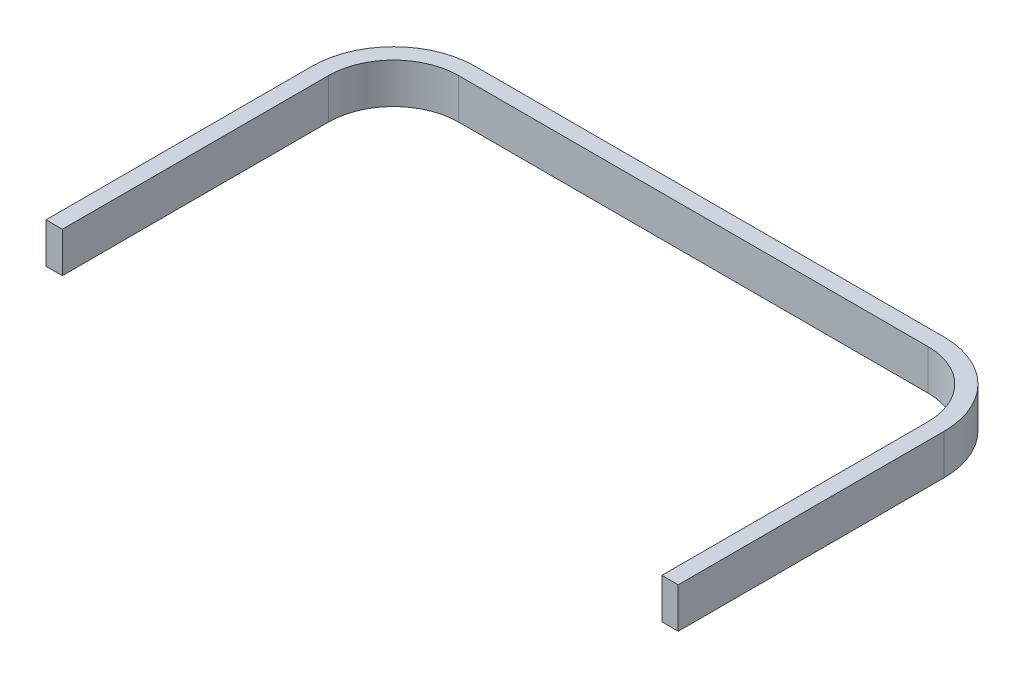
from build123d import *

# Parameters (mm, degrees)
SKETCH2_W = 42.447903748
SKETCH2_H = 104.615154758


with BuildPart() as part:
    # Sweep1: sweep along a path in Sketch1
    with BuildLine(Plane(origin=(0, 0, 0), x_dir=(1, 0, 0), z_dir=(0, 1, 0))) as sweep1_path:
        Line((0, 762.84918933), (-609.6, 762.84918933))
        ThreePointArc((-609.6, 762.84918933), (-744.303841816, 707.053031146), (-800.1, 572.34918933))
        Line((-800.1, 572.34918933), (-800.1, -118.947967944))
    # Sketch2 → Sweep1 (sweep)
    with BuildSketch(Plane(origin=(-800.1, 0, 118.947967944), x_dir=(1, 0, 0), z_dir=(0, 0, 1))):
        Rectangle(SKETCH2_W, SKETCH2_H)
    sweep1 = sweep(path=sweep1_path.line)

    # Mirror1: Sweep1 across plane
    add(sweep1.mirror(Plane(origin=(0, 0, 37.25081067), x_dir=(0, 0, 1), z_dir=(1, 0, 0))))


solid = part.part
